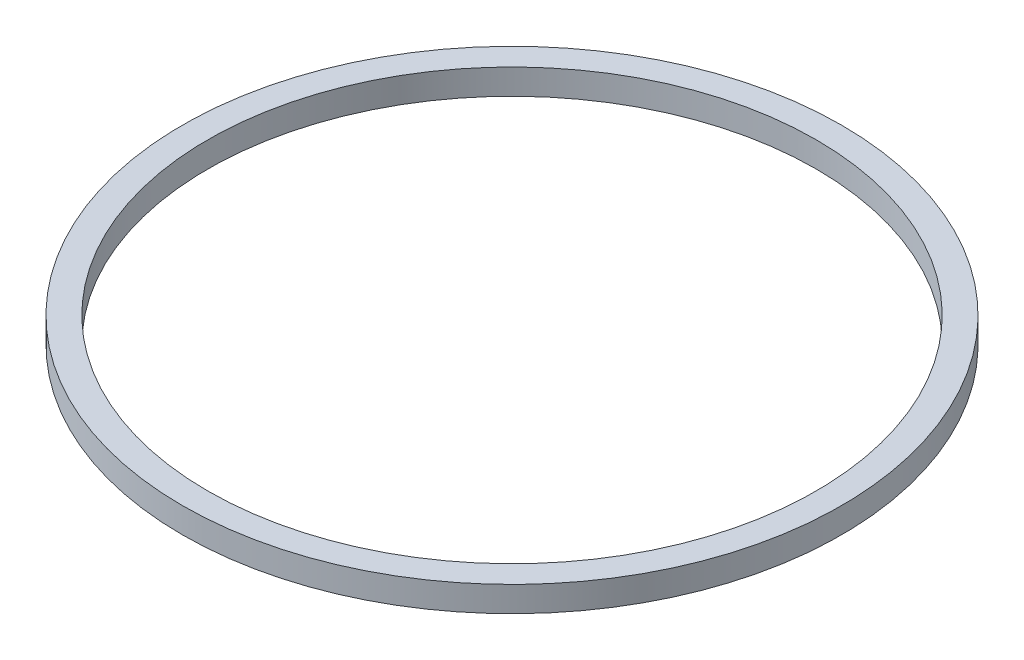
from build123d import *

# Parameters (mm, degrees)
IZIM1_R                     = 130
IZIM1_R_2                   = 120
Y_KSEKLIK_EKSTR_ZYON1_DEPTH = 10


with BuildPart() as part:
    # Çizim1 → Yükseklik-Ekstrüzyon1 (new body)
    with BuildSketch(Plane(origin=(0, 0, 0), x_dir=(1, 0, 0), z_dir=(0, 1, 0))):
        with Locations(Location((0, 0, 0), (0, 0, 270))):
            Circle(IZIM1_R)
        with Locations(Location((0, 0, 0), (0, 0, 270))):
            Circle(IZIM1_R_2, mode=Mode.SUBTRACT)
    extrude(amount=Y_KSEKLIK_EKSTR_ZYON1_DEPTH)


solid = part.part
